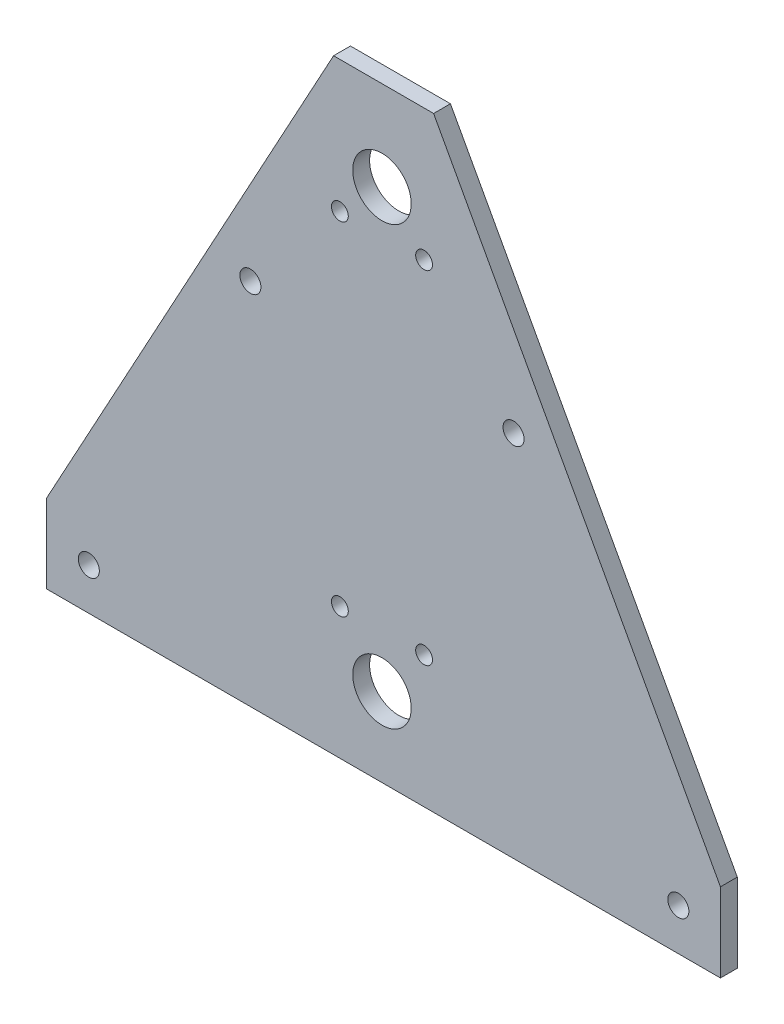
from build123d import *

# Parameters (mm, degrees)
SKETCH2_R           = 27.775
SKETCH2_R_2         = 8
SKETCH2_R_3         = 10
BOSS_EXTRUDE1_DEPTH = 16


with BuildPart() as part:
    # Sketch2 → Boss-Extrude1 (new body)
    with BuildSketch(Plane.XY):
        Polygon((0, 0), (640, 0), (640, 75), (367.510391728, 575), (272.510391728, 575), (0, 75), align=None)
        with Locations((318.4763261, 490)):
            Circle(SKETCH2_R, mode=Mode.SUBTRACT)
        with Locations((278.4763261, 450)):
            Circle(SKETCH2_R_2, mode=Mode.SUBTRACT)
        with Locations((358.4763261, 450)):
            Circle(SKETCH2_R_2, mode=Mode.SUBTRACT)
        with Locations((193.4763261, 350)):
            Circle(SKETCH2_R_3, mode=Mode.SUBTRACT)
        with Locations((443.4763261, 350)):
            Circle(SKETCH2_R_3, mode=Mode.SUBTRACT)
        with Locations((278.4763261, 125.024449421)):
            Circle(SKETCH2_R_2, mode=Mode.SUBTRACT)
        with Locations((358.4763261, 125.024449421)):
            Circle(SKETCH2_R_2, mode=Mode.SUBTRACT)
        with Locations((318.4763261, 75)):
            Circle(SKETCH2_R, mode=Mode.SUBTRACT)
        with Locations((40, 39.764905221)):
            Circle(SKETCH2_R_3, mode=Mode.SUBTRACT)
        with Locations((600, 39.764905221)):
            Circle(SKETCH2_R_3, mode=Mode.SUBTRACT)
    extrude(amount=BOSS_EXTRUDE1_DEPTH)


solid = part.part
